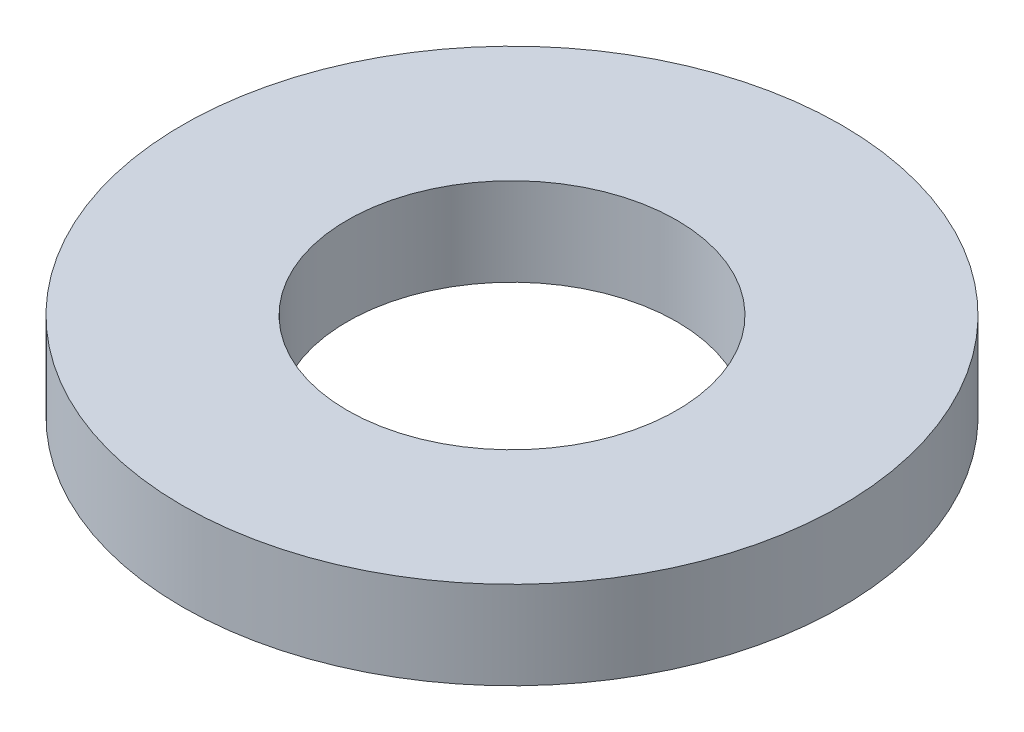
from build123d import *

# Parameters (mm, degrees)
SKETCH_1_R      = 3
SKETCH_1_R_2    = 1.5
EXTRUDE_1_DEPTH = 0.8


with BuildPart() as part:
    # 草图1 → 凸台-拉伸1 (new body)
    with BuildSketch(Plane(origin=(0, 0, 0), x_dir=(1, 0, 0), z_dir=(0, 1, 0))):
        with Locations(Location((0, 0, 0), (0, 0, 270))):
            Circle(SKETCH_1_R)
        with Locations(Location((0, 0, 0), (0, 0, 270))):
            Circle(SKETCH_1_R_2, mode=Mode.SUBTRACT)
    extrude(amount=EXTRUDE_1_DEPTH)


solid = part.part
